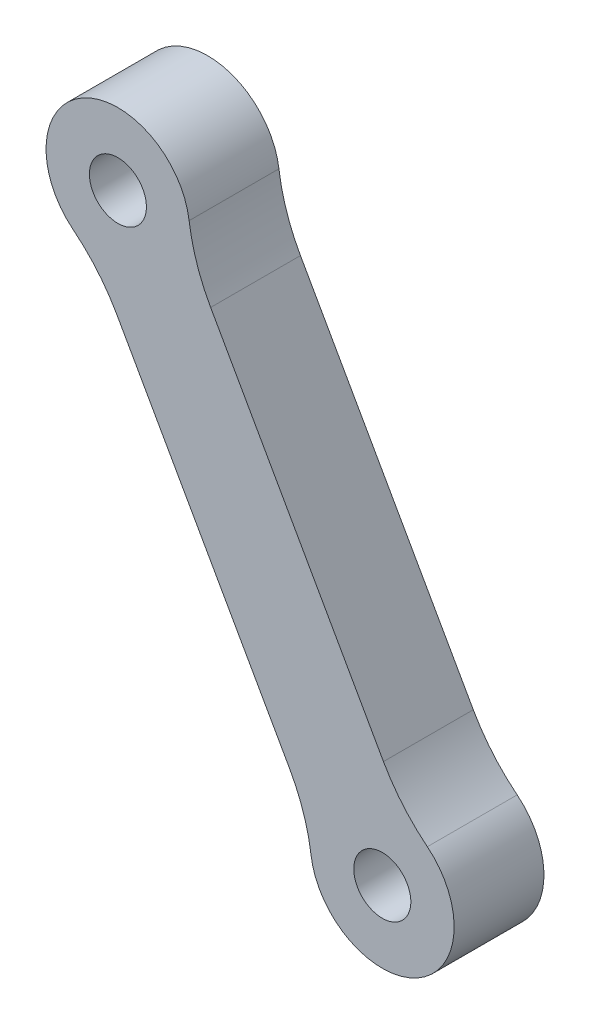
from build123d import *

# Parameters (mm, degrees)
SKETCH1_R           = 2
BOSS_EXTRUDE1_DEPTH = 5
SKETCH2_R           = 2
SKETCH2_R_2         = 1.5875
BOSS_EXTRUDE2_DEPTH = 5
SKETCH3_R           = 2
SKETCH3_R_2         = 1.5875
BOSS_EXTRUDE3_DEPTH = 5


with BuildPart() as part:
    # Sketch1 → Boss-Extrude1 (new body)
    with BuildSketch(Plane.XY.offset(63)):
        with BuildLine():
            Line((8.181928414, -16.605718064), (17.802171103, -33.691169181))
            ThreePointArc((17.802171103, -33.691169181), (18.572370652, -35.426303597), (19.000782012, -37.275725803))
            ThreePointArc((19.000782012, -37.275725803), (24.928229029, -40.232462465), (25.473776059, -33.631000637))
            ThreePointArc((25.473776059, -33.631000637), (24.114589128, -32.30566684), (23.030358602, -30.747352701))
            Line((23.030358602, -30.747352701), (13.410115914, -13.661901584))
            ThreePointArc((13.410115914, -13.661901584), (12.639916365, -11.926767167), (12.211505005, -10.077344962))
            ThreePointArc((12.211505005, -10.077344962), (6.284057988, -7.1206083), (5.738510958, -13.722070128))
            ThreePointArc((5.738510958, -13.722070128), (7.097697889, -15.047403925), (8.181928414, -16.605718064))
        make_face()
        with Locations(Location((8.246602308, -10.606066633, 0), (0, 0, 180))):
            Circle(SKETCH1_R, mode=Mode.SUBTRACT)
        with Locations(Location((22.965684708, -36.747004132, 0), (0, 0, 180))):
            Circle(SKETCH1_R, mode=Mode.SUBTRACT)
    extrude(amount=-BOSS_EXTRUDE1_DEPTH)

    # Sketch2 → Boss-Extrude2 (add, through all)
    with BuildSketch(Plane(origin=(0, 0, 58), x_dir=(-1, 0, 0), z_dir=(0, 0, -1))):
        with Locations((-22.965684708, -36.747004132)):
            Circle(SKETCH2_R)
        with Locations((-22.965684708, -36.747004132)):
            Circle(SKETCH2_R_2, mode=Mode.SUBTRACT)
    extrude(amount=-BOSS_EXTRUDE2_DEPTH)

    # Sketch3 → Boss-Extrude3 (add, through all)
    with BuildSketch(Plane(origin=(0, 0, 58), x_dir=(-1, 0, 0), z_dir=(0, 0, -1))):
        with Locations((-8.246602308, -10.606066633)):
            Circle(SKETCH3_R)
        with Locations((-8.246602308, -10.606066633)):
            Circle(SKETCH3_R_2, mode=Mode.SUBTRACT)
    extrude(amount=-BOSS_EXTRUDE3_DEPTH)


solid = part.part
